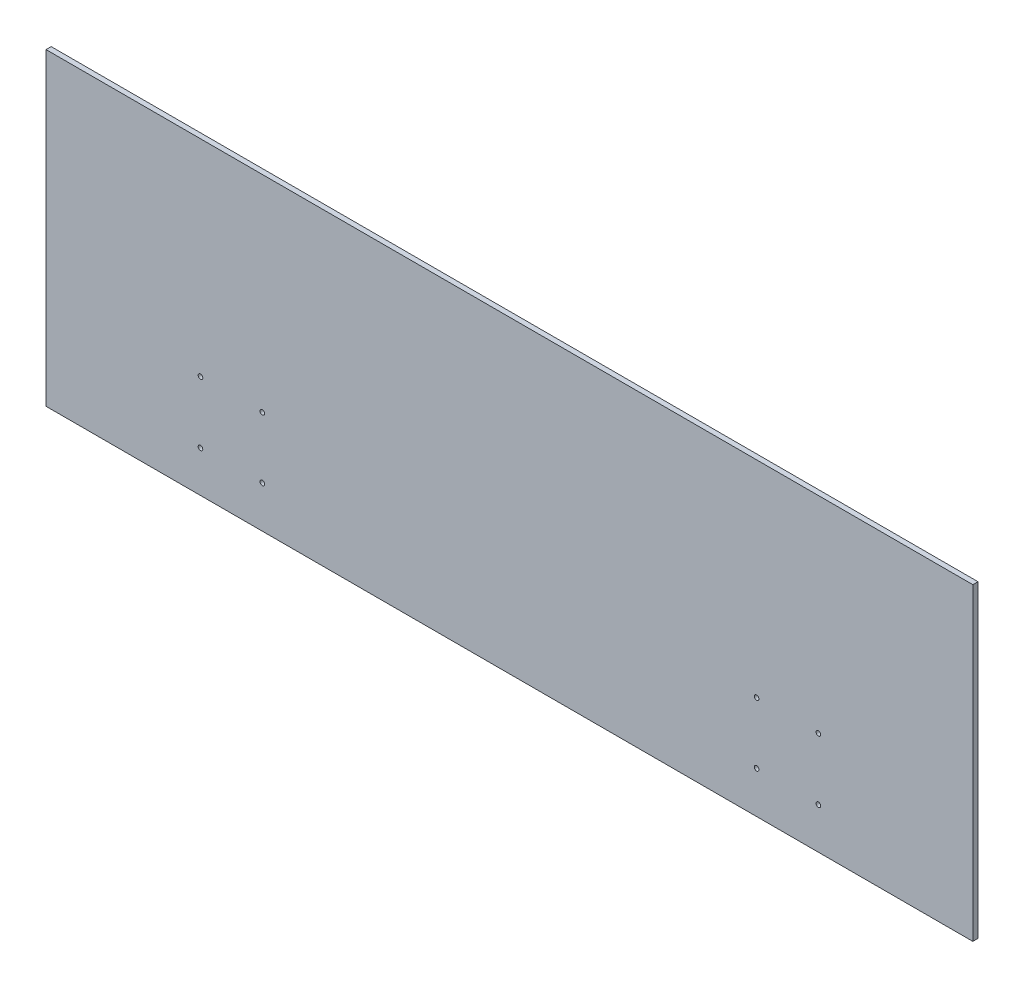
from build123d import *

# Parameters (mm, degrees)
SKETCH1_W           = 900
SKETCH1_H           = 300
SKETCH1_R           = 2.25
BOSS_EXTRUDE1_DEPTH = 5


with BuildPart() as part:
    # Sketch1 → Boss-Extrude1 (new body)
    with BuildSketch(Plane.XY):
        with Locations((153.736654804, 42.971530249)):
            Rectangle(SKETCH1_W, SKETCH1_H)
        with Locations((-146.263345196, -7.028469751)):
            Circle(SKETCH1_R, mode=Mode.SUBTRACT)
        with Locations((-86.263345196, -7.028469751)):
            Circle(SKETCH1_R, mode=Mode.SUBTRACT)
        with Locations((-86.263345196, -66.459074733)):
            Circle(SKETCH1_R, mode=Mode.SUBTRACT)
        with Locations((-146.263345196, -67.028469751)):
            Circle(SKETCH1_R, mode=Mode.SUBTRACT)
        with Locations(Location((453.736654804, -67.028469751, 0), (0, 0, 180))):
            Circle(SKETCH1_R, mode=Mode.SUBTRACT)
        with Locations(Location((393.736654804, -66.459074733, 0), (0, 0, 180))):
            Circle(SKETCH1_R, mode=Mode.SUBTRACT)
        with Locations(Location((393.736654804, -7.028469751, 0), (0, 0, 180))):
            Circle(SKETCH1_R, mode=Mode.SUBTRACT)
        with Locations(Location((453.736654804, -7.028469751, 0), (0, 0, 180))):
            Circle(SKETCH1_R, mode=Mode.SUBTRACT)
    extrude(amount=BOSS_EXTRUDE1_DEPTH)


solid = part.part
